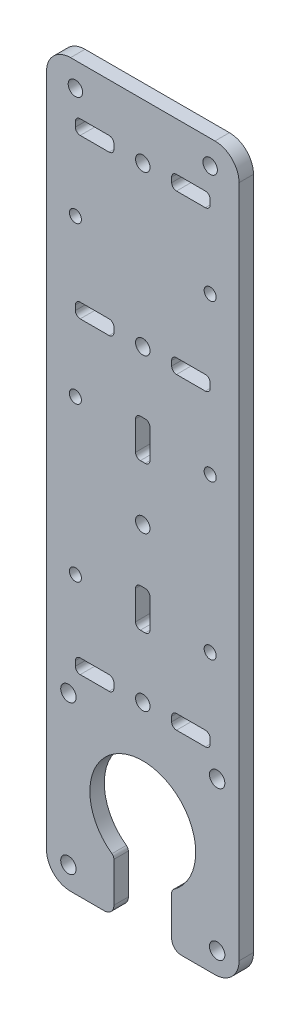
from build123d import *

# Parameters (mm, degrees)
SKETCH1_R                      = 1.6
BOSS_EXTRUDE1_DEPTH            = 3
FILLET1_R                      = 5
FILLET2_R                      = 2
FILLET3_R                      = 1
SKETCH2_W                      = 8
SKETCH2_H                      = 3
SKETCH2_R                      = 1.5
CUT_EXTRUDE1_DEPTH             = 3
FILLET4_R                      = 1
F_2_5_2_5_DIAMETER_HOLE1_D     = 2.5
F_2_5_2_5_DIAMETER_HOLE1_DEPTH = 6
F_2_5_2_5_DIAMETER_HOLE1_TIP   = 0.751075774
SKETCH8_R                      = 1.5
CUT_EXTRUDE2_DEPTH             = 10
SKETCH9_W                      = 3
SKETCH9_H                      = 8
CUT_EXTRUDE3_DEPTH             = 10
FILLET7_R                      = 1


with BuildPart() as part:
    # Sketch1 → Boss-Extrude1 (new body)
    with BuildSketch(Plane.XY):
        with BuildLine():
            Line((20, 75), (-20, 75))
            Line((-20, 75), (-20, -75))
            Line((-20, -75), (-6, -75))
            Line((-6, -75), (-6, -64.219544457))
            ThreePointArc((-6, -64.219544457), (-5.244044241, -45.330460197), (11, -55))
            ThreePointArc((11, -55), (9.669539803, -60.244044241), (6, -64.219544457))
            Line((6, -64.219544457), (6, -75))
            Line((6, -75), (20, -75))
            Line((20, -75), (20, 75))
        make_face()
        with Locations((-15.450283169, -70.450283169)):
            Circle(SKETCH1_R, mode=Mode.SUBTRACT)
        with Locations((-15.450283169, -39.549716831)):
            Circle(SKETCH1_R, mode=Mode.SUBTRACT)
        with Locations((15.450283169, -70.450283169)):
            Circle(SKETCH1_R, mode=Mode.SUBTRACT)
        with Locations((15.450283169, -39.549716831)):
            Circle(SKETCH1_R, mode=Mode.SUBTRACT)
    extrude(amount=BOSS_EXTRUDE1_DEPTH)

    # Fillet1
    fillet1_edges = [part.edges().sort_by_distance(p)[0] for p in [
        (-20, -75, 1.5),
        (20, -75, 1.5),
        (-20, 75, 1.5),
        (20, 75, 1.5),
    ]]
    fillet(fillet1_edges, radius=FILLET1_R)

    # Fillet2
    fillet2_edges = [part.edges().sort_by_distance(p)[0] for p in [
        (6, -75, 1.5),
        (-6, -75, 1.5),
    ]]
    fillet(fillet2_edges, radius=FILLET2_R)

    # Fillet3
    fillet3_edges = [part.edges().sort_by_distance(p)[0] for p in [
        (6, -64.219544457, 1.5),
        (-6, -64.219544457, 1.5),
    ]]
    fillet(fillet3_edges, radius=FILLET3_R)

    # Sketch2 → Cut-Extrude1 (cut)
    with BuildSketch(Plane.XY.offset(3)):
        with Locations((-10, 63.5)):
            Rectangle(SKETCH2_W, SKETCH2_H)
        with Locations((10, 63.5)):
            Rectangle(SKETCH2_W, SKETCH2_H)
        with Locations((-10, 30.5)):
            Rectangle(SKETCH2_W, SKETCH2_H)
        with Locations((10, 30.5)):
            Rectangle(SKETCH2_W, SKETCH2_H)
        with Locations((-10, -33.5)):
            Rectangle(SKETCH2_W, SKETCH2_H)
        with Locations((10, -33.5)):
            Rectangle(SKETCH2_W, SKETCH2_H)
        with Locations((0, -33.5)):
            Circle(SKETCH2_R)
        with Locations((0, 30.5)):
            Circle(SKETCH2_R)
        with Locations((0, 63.5)):
            Circle(SKETCH2_R)
        with Locations((0, -1.5)):
            Circle(SKETCH2_R)
    extrude(amount=-CUT_EXTRUDE1_DEPTH, mode=Mode.SUBTRACT)

    # Fillet4
    fillet4_edges = [part.edges().sort_by_distance(p)[0] for p in [
        (-6, 29, 1.5),
        (-14, 29, 1.5),
        (-6, 32, 1.5),
        (14, -35, 1.5),
        (6, -35, 1.5),
        (6, -32, 1.5),
        (14, -32, 1.5),
        (-6, -35, 1.5),
        (-14, -35, 1.5),
        (-14, -32, 1.5),
        (-6, -32, 1.5),
        (14, 29, 1.5),
        (6, 29, 1.5),
        (6, 32, 1.5),
        (14, 32, 1.5),
        (-14, 32, 1.5),
        (14, 65, 1.5),
        (14, 62, 1.5),
        (6, 65, 1.5),
        (6, 62, 1.5),
        (-14, 62, 1.5),
        (-6, 62, 1.5),
        (-6, 65, 1.5),
        (-14, 65, 1.5),
    ]]
    fillet(fillet4_edges, radius=FILLET4_R)

    # Ø2.5 (2.5) Diameter Hole1
    with Locations(Plane.XY.offset(3)):
        with Locations((14, -17.5), (-14, -17.5), (-14, 14.5), (14, 14.5), (14, 47), (-14, 47)):
            Hole(F_2_5_2_5_DIAMETER_HOLE1_D / 2, depth=F_2_5_2_5_DIAMETER_HOLE1_DEPTH)
            with Locations((0, 0, -(F_2_5_2_5_DIAMETER_HOLE1_DEPTH + F_2_5_2_5_DIAMETER_HOLE1_TIP / 2))):  # 118° drill point
                Cone(0, F_2_5_2_5_DIAMETER_HOLE1_D / 2, F_2_5_2_5_DIAMETER_HOLE1_TIP, mode=Mode.SUBTRACT)

    # Sketch8 → Cut-Extrude2 (cut)
    with BuildSketch(Plane.XY.offset(3)):
        with Locations((-14, 70)):
            Circle(SKETCH8_R)
        with Locations((14, 70)):
            Circle(SKETCH8_R)
    extrude(amount=-CUT_EXTRUDE2_DEPTH, mode=Mode.SUBTRACT)

    # Sketch9 → Cut-Extrude3 (cut)
    with BuildSketch(Plane.XY.offset(3)):
        with Locations((0, -16.75)):
            Rectangle(SKETCH9_W, SKETCH9_H)
        with Locations((0, 13.75)):
            Rectangle(SKETCH9_W, SKETCH9_H)
    extrude(amount=-CUT_EXTRUDE3_DEPTH, mode=Mode.SUBTRACT)

    # Fillet7
    fillet7_edges = [part.edges().sort_by_distance(p)[0] for p in [
        (-1.5, 9.75, 1.5),
        (-1.5, 17.75, 1.5),
        (1.5, 17.75, 1.5),
        (1.5, 9.75, 1.5),
        (1.5, -20.75, 1.5),
        (-1.5, -20.75, 1.5),
        (-1.5, -12.75, 1.5),
        (1.5, -12.75, 1.5),
    ]]
    fillet(fillet7_edges, radius=FILLET7_R)


solid = part.part
